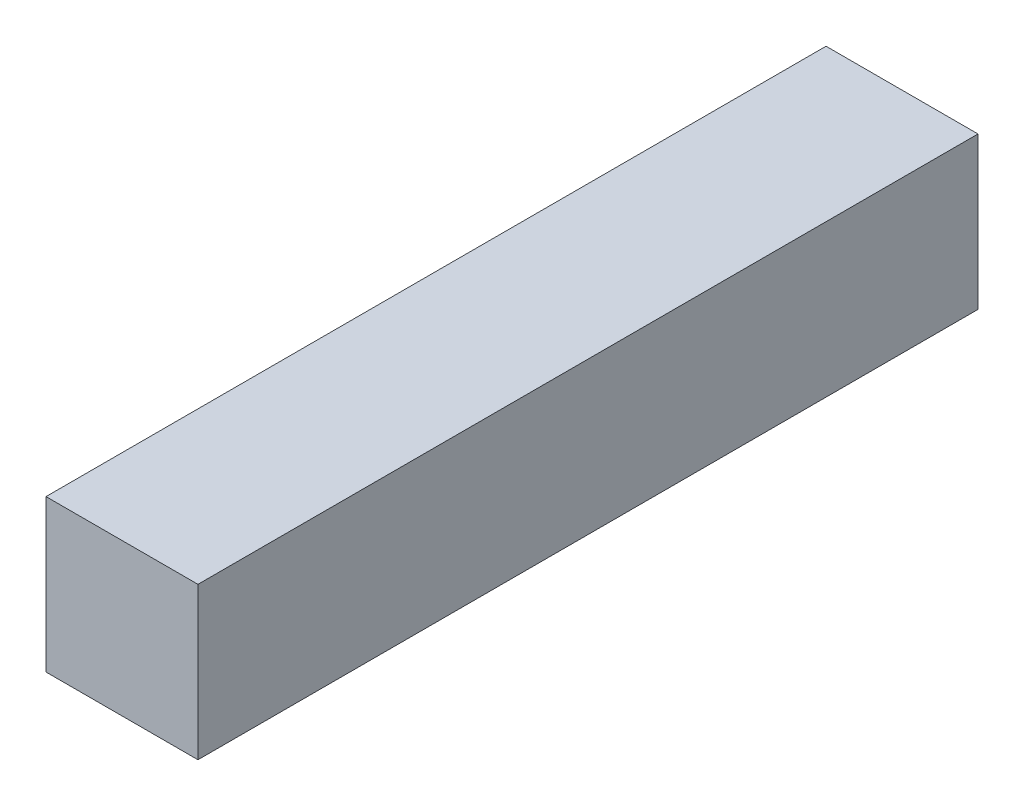
from build123d import *

# Parameters (mm, degrees)
SKETCH_256_W    = 15
SKETCH_256_H    = 15
EXTRUDE_1_DEPTH = 77


with BuildPart() as part:
    # Sketch 256 → Бобышка-Вытянуть1 (new body)
    with BuildSketch(Plane.XY):
        Rectangle(SKETCH_256_W, SKETCH_256_H)
    extrude(amount=EXTRUDE_1_DEPTH)


solid = part.part
